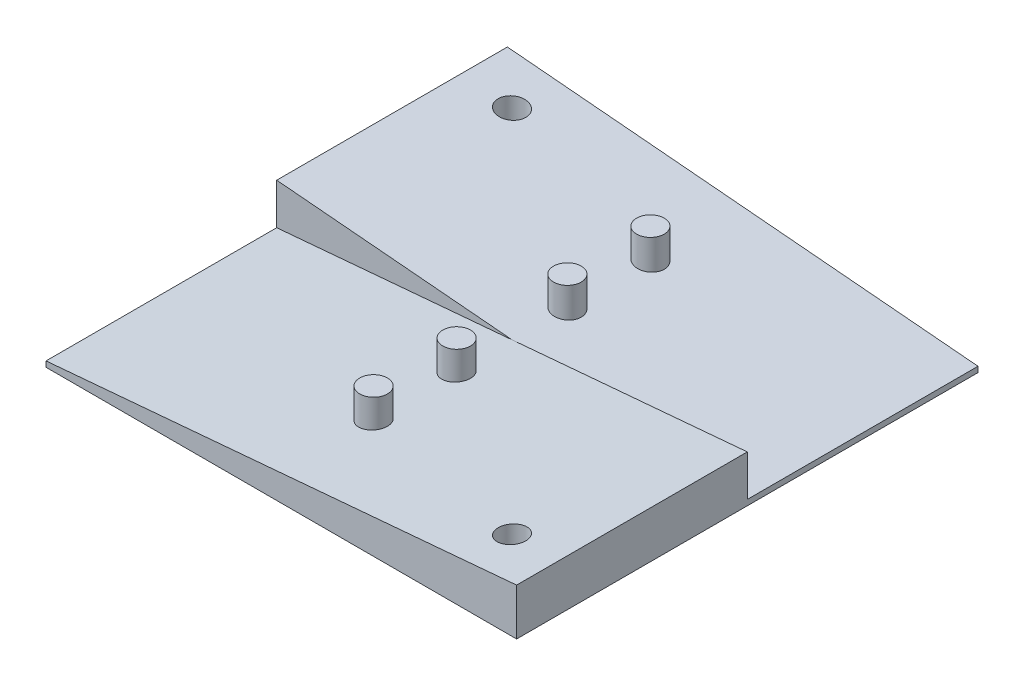
from build123d import *

# Parameters (mm, degrees)
ESBO_O2_W                = 51
ESBO_O2_H                = 50
RESSALTO_EXTRUS_O2_DEPTH = 6
CORTE_EXTRUS_O1_DEPTH    = 25
CORTE_EXTRUS_O3_DEPTH    = 25
ESBO_O5_R                = 1.5
RESSALTO_EXTRUS_O3_DEPTH = 6
ESBO_O8_R                = 1.5
CORTE_EXTRUS_O6_DEPTH    = 37.211186117
CHANFRO1_SIZE            = 1.5


with BuildPart() as part:
    # Esboço2 → Ressalto-extrusão2 (new body)
    with BuildSketch(Plane(origin=(0, 0, 0), x_dir=(1, 0, 0), z_dir=(0, 1, 0))):
        Rectangle(ESBO_O2_W, ESBO_O2_H)
    extrude(amount=RESSALTO_EXTRUS_O2_DEPTH)

    # Esboço3 → Corte-extrusão1 (cut)
    with BuildSketch(Plane.XY.offset(25)):
        Polygon((-25.5, 0.6), (25.5, 5.06192184), (25.5, 6), (-25.5, 6), align=None)
    extrude(amount=-CORTE_EXTRUS_O1_DEPTH, mode=Mode.SUBTRACT)

    # Esboço4 → Corte-extrusão3 (cut)
    with BuildSketch(Plane(origin=(0, 0, -25), x_dir=(-1, 0, 0), z_dir=(0, 0, -1))):
        Polygon((-25.5, 0.6), (25.5, 5.06192184), (25.5, 6), (-25.5, 6), align=None)
    extrude(amount=-CORTE_EXTRUS_O3_DEPTH, mode=Mode.SUBTRACT)

    # Esboço5 → Ressalto-extrusão3 (add)
    with BuildSketch(Plane.XZ):
        with Locations(Location((0, 6, 0), (0, 0, 270))):
            Circle(ESBO_O5_R)
        with Locations(Location((0, 15, 0), (0, 0, 270))):
            Circle(ESBO_O5_R)
        with Locations(Location((0, -15, 0), (0, 0, 270))):
            Circle(ESBO_O5_R)
        with Locations(Location((0, -6, 0), (0, 0, 270))):
            Circle(ESBO_O5_R)
    extrude(amount=-RESSALTO_EXTRUS_O3_DEPTH)

    # Esboço8 → Corte-extrusão6 (cut, through all)
    with BuildSketch(Plane.XZ):
        with Locations(Location((20, 20, 0), (0, 0, 270))):
            Circle(ESBO_O8_R)
        with Locations(Location((-20, -20, 0), (0, 0, 270))):
            Circle(ESBO_O8_R)
    extrude(amount=-CORTE_EXTRUS_O6_DEPTH, mode=Mode.SUBTRACT)

    # Chanfro1
    chanfro1_edges = [part.edges().sort_by_distance(p)[0] for p in [
        (20, 0, 21.5),
        (-20, 0, -18.5),
    ]]
    chamfer(chanfro1_edges, length=CHANFRO1_SIZE)


solid = part.part
